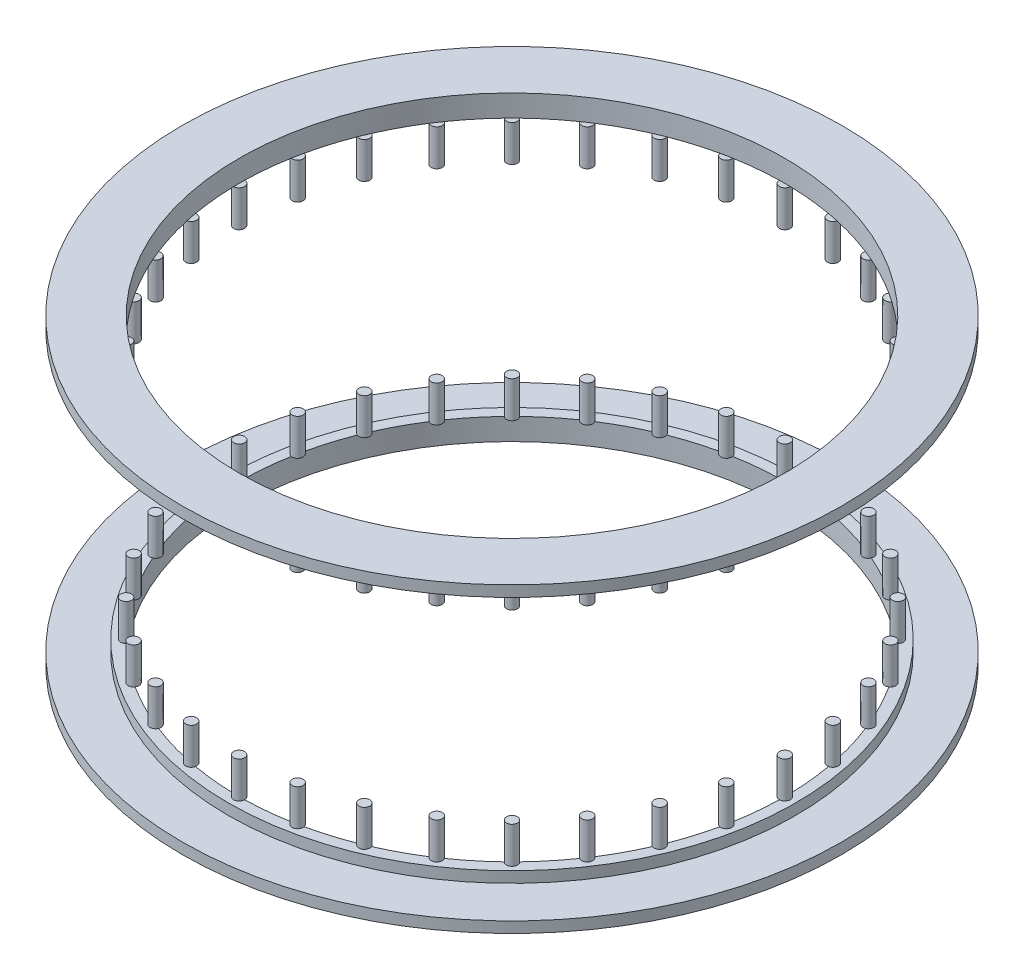
from build123d import *

# Parameters (mm, degrees)
SKETCH2_R           = 7.5
BOSS_EXTRUDE1_DEPTH = 50


with BuildPart() as part:
    # Sketch1 → Revolve1 (revolve)
    with BuildSketch(Plane(origin=(0, 0, 0), x_dir=(0, 0, -1), z_dir=(1, 0, 0))):
        Polygon((-375, 207.5), (-453.195878299, 207.5), (-453.195878299, 192.5), (-390, 192.5), (-390, 177.5), (-375, 177.5), align=None)
        Polygon((-390, -177.5), (-390, -192.5), (-453.195878299, -192.5), (-453.195878299, -207.5), (-375, -207.5), (-375, -177.5), align=None)
    revolve(axis=Axis((0, 380.511182109, 0), (0, -1, 0)))

    # Sketch2 → Boss-Extrude1 (add)
    with BuildSketch(Plane(origin=(0, -177.5, 0), x_dir=(1, 0, 0), z_dir=(0, 1, 0))):
        with Locations(Location((0, 375, 0), (0, 0, 180.572967345))):
            Circle(SKETCH2_R)
        with Locations(Location((73.158870756, 367.794480151, 0), (0, 0, 169.322967345))):
            Circle(SKETCH2_R)
        with Locations(Location((143.506287137, 346.454824692, 0), (0, 0, 158.072967345))):
            Circle(SKETCH2_R)
        with Locations(Location((208.338837382, 311.801104613, 0), (0, 0, 146.822967345))):
            Circle(SKETCH2_R)
        with Locations(Location((265.165042945, 265.165042945, 0), (0, 0, 135.572967345))):
            Circle(SKETCH2_R)
        with Locations(Location((311.801104613, 208.338837382, 0), (0, 0, 124.322967345))):
            Circle(SKETCH2_R)
        with Locations(Location((346.454824692, 143.506287137, 0), (0, 0, 113.072967345))):
            Circle(SKETCH2_R)
        with Locations(Location((367.794480151, 73.158870756, 0), (0, 0, 101.822967345))):
            Circle(SKETCH2_R)
        with Locations(Location((375, 0, 0), (0, 0, 90.572967345))):
            Circle(SKETCH2_R)
        with Locations(Location((367.794480151, -73.158870756, 0), (0, 0, 79.322967345))):
            Circle(SKETCH2_R)
        with Locations(Location((346.454824692, -143.506287137, 0), (0, 0, 68.072967345))):
            Circle(SKETCH2_R)
        with Locations(Location((311.801104613, -208.338837382, 0), (0, 0, 56.822967345))):
            Circle(SKETCH2_R)
        with Locations(Location((265.165042945, -265.165042945, 0), (0, 0, 45.572967345))):
            Circle(SKETCH2_R)
        with Locations(Location((208.338837382, -311.801104613, 0), (0, 0, 34.322967345))):
            Circle(SKETCH2_R)
        with Locations(Location((143.506287137, -346.454824692, 0), (0, 0, 23.072967345))):
            Circle(SKETCH2_R)
        with Locations(Location((73.158870756, -367.794480151, 0), (0, 0, 11.822967345))):
            Circle(SKETCH2_R)
        with Locations(Location((0, -375, 0), (0, 0, 179.427032655))):
            Circle(SKETCH2_R)
        with Locations(Location((-73.158870756, -367.794480151, 0), (0, 0, 168.177032655))):
            Circle(SKETCH2_R)
        with Locations(Location((-143.506287137, -346.454824692, 0), (0, 0, 156.927032655))):
            Circle(SKETCH2_R)
        with Locations(Location((-208.338837382, -311.801104613, 0), (0, 0, 145.677032655))):
            Circle(SKETCH2_R)
        with Locations(Location((-265.165042945, -265.165042945, 0), (0, 0, 134.427032655))):
            Circle(SKETCH2_R)
        with Locations(Location((-311.801104613, -208.338837382, 0), (0, 0, 123.177032655))):
            Circle(SKETCH2_R)
        with Locations(Location((-346.454824692, -143.506287137, 0), (0, 0, 111.927032655))):
            Circle(SKETCH2_R)
        with Locations(Location((-367.794480151, -73.158870756, 0), (0, 0, 100.677032655))):
            Circle(SKETCH2_R)
        with Locations(Location((-375, 0, 0), (0, 0, 89.427032655))):
            Circle(SKETCH2_R)
        with Locations(Location((-367.794480151, 73.158870756, 0), (0, 0, 78.177032655))):
            Circle(SKETCH2_R)
        with Locations(Location((-346.454824692, 143.506287137, 0), (0, 0, 66.927032655))):
            Circle(SKETCH2_R)
        with Locations(Location((-311.801104613, 208.338837382, 0), (0, 0, 55.677032655))):
            Circle(SKETCH2_R)
        with Locations(Location((-265.165042945, 265.165042945, 0), (0, 0, 44.427032655))):
            Circle(SKETCH2_R)
        with Locations(Location((-208.338837382, 311.801104613, 0), (0, 0, 33.177032655))):
            Circle(SKETCH2_R)
        with Locations(Location((-143.506287137, 346.454824692, 0), (0, 0, 21.927032655))):
            Circle(SKETCH2_R)
        with Locations(Location((-73.158870756, 367.794480151, 0), (0, 0, 10.677032655))):
            Circle(SKETCH2_R)
    boss_extrude1 = extrude(amount=BOSS_EXTRUDE1_DEPTH)

    # Mirror1: Boss-Extrude1 across plane
    add(boss_extrude1.mirror(Plane(origin=(0, 0, 0), x_dir=(0, 0, 1), z_dir=(0, -1, 0))))


solid = part.part
